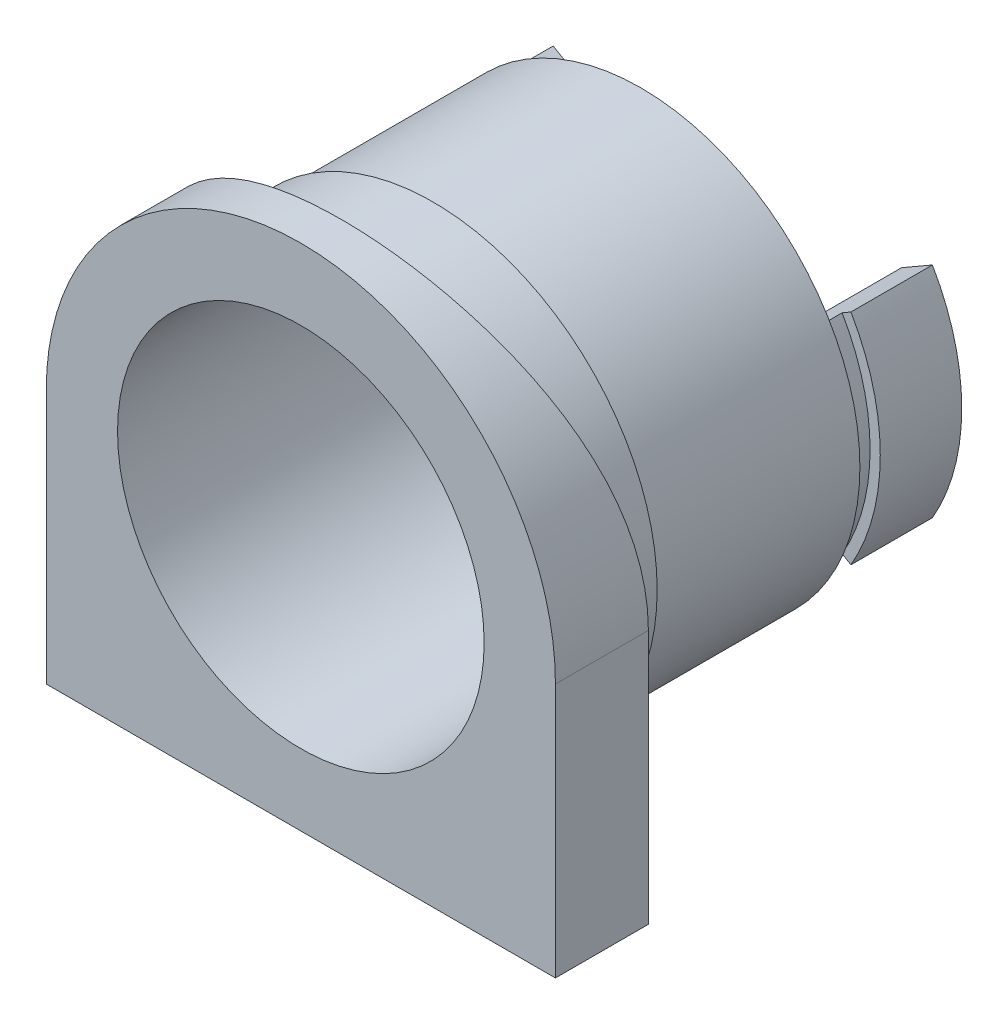
from build123d import *
from build123d.topology import SkipClean

# Parameters (mm, degrees)
EXTRUDE_1_DEPTH     = 25
SKETCH_2_R          = 9
CUT_EXTRUDE_2_DEPTH = 29.321046499
SKETCH_3_R          = 11
SKETCH_3_R_2        = 9
TUBE_DEPTH          = 16.7
SUPPORT_DEPTH       = 5
HOLDER_START        = -15.205
SKETCH_5_R          = 11
SKETCH_5_R_2        = 10.75
HOLDER_DEPTH        = 15.205
SKETCH_7_W          = 0.5
SKETCH_7_H          = 1
SKETCH_8_OUTSIDE_W  = 35.296
SKETCH_8_OUTSIDE_H  = 35.296
CUT_EXTRUDE_3_DEPTH = 10


with BuildPart() as part:
    # Эскиз1 → Вытянуть1 (new body)
    with BuildSketch(Plane(origin=(0, 0, 0), x_dir=(1, 0, 0), z_dir=(0, 1, 0))):
        with BuildLine():
            Line((-12.5, -29.18582704), (-12.5, -33.75))
            Line((-12.5, -33.75), (12.5, -33.75))
            Line((12.5, -33.75), (12.5, -29.18582704))
            ThreePointArc((12.5, -29.18582704), (0, -31.75), (-12.5, -29.18582704))
        make_face()
    extrude(amount=EXTRUDE_1_DEPTH)

    # Эскиз2 → Вытянуть2 (cut, through all)
    with BuildSketch(Plane.XY.offset(33.75)):
        with Locations((0, 12.5)):
            Circle(SKETCH_2_R)
    extrude(amount=-CUT_EXTRUDE_2_DEPTH, mode=Mode.SUBTRACT)

    # Эскиз3 → tube (add)
    with BuildSketch(Plane.XY.offset(33.75)):
        with Locations((0, 12.5)):
            Circle(SKETCH_3_R)
        with Locations((0, 12.5)):
            Circle(SKETCH_3_R_2, mode=Mode.SUBTRACT)
    extrude(amount=-TUBE_DEPTH)

    # Эскиз4 → support (add)
    with SkipClean():  # the faces are left unmerged after this step: merging them gives an invalid solid
        with BuildSketch(Plane(origin=(0, 0, 17.05), x_dir=(-1, 0, 0), z_dir=(0, 0, -1))):
            with BuildLine():
                Line((7.794228634, 17), (9.526279442, 18))
                ThreePointArc((9.526279442, 18), (11, 12.5), (9.526279442, 7))
                Line((9.526279442, 7), (7.794228634, 8))
                ThreePointArc((7.794228634, 8), (9, 12.5), (7.794228634, 17))
            make_face()
            with BuildLine():
                Line((-7.794228634, 8), (-9.526279442, 7))
                ThreePointArc((-9.526279442, 7), (-11, 12.5), (-9.526279442, 18))
                Line((-9.526279442, 18), (-7.794228634, 17))
                ThreePointArc((-7.794228634, 17), (-9, 12.5), (-7.794228634, 8))
            make_face()
        extrude(amount=SUPPORT_DEPTH)

    # Эскиз5 → holder (cut)
    with SkipClean():  # the faces are left unmerged after this step: merging them gives an invalid solid
        with BuildSketch(Plane(origin=(0, 0, 12.05), x_dir=(-1, 0, 0), z_dir=(0, 0, -1)).offset(HOLDER_START)):
            with Locations((0, 12.5)):
                Circle(SKETCH_5_R)
            with Locations((0, 12.5)):
                Circle(SKETCH_5_R_2, mode=Mode.SUBTRACT)
        extrude(amount=HOLDER_DEPTH, mode=Mode.SUBTRACT)

    # Эскиз7 → Вырез-Повернуть2 (revolve, cut)
    with SkipClean():  # the faces are left unmerged after this step: merging them gives an invalid solid
        with BuildSketch(Plane(origin=(-5.412658774, 9.375, 0), x_dir=(0.8660254037844456, 0.4999999999999881, 0), z_dir=(-0.4999999999999881, 0.8660254037844456, 0))):
            with Locations((16.75, -16.55)):
                Rectangle(SKETCH_7_W, SKETCH_7_H)
        revolve(axis=Axis((0, 12.5, 12.049975), (0, 0, 1)), mode=Mode.SUBTRACT)

    # Эскиз8 outside → Вытянуть3 (cut)
    with SkipClean():  # the faces are left unmerged after this step: merging them gives an invalid solid
        with BuildSketch(Plane.XY.offset(33.75)):
            with Locations((0, 12.5)):
                Rectangle(SKETCH_8_OUTSIDE_W, SKETCH_8_OUTSIDE_H)
            with BuildLine():
                Line((-12.5, 12.5), (-12.5, 0))
                Line((-12.5, 0), (12.5, 0))
                Line((12.5, 0), (12.5, 12.5))
                ThreePointArc((12.5, 12.5), (0, 25), (-12.5, 12.5))
            make_face(mode=Mode.SUBTRACT)
        extrude(amount=-CUT_EXTRUDE_3_DEPTH, mode=Mode.SUBTRACT)


solid = part.part
